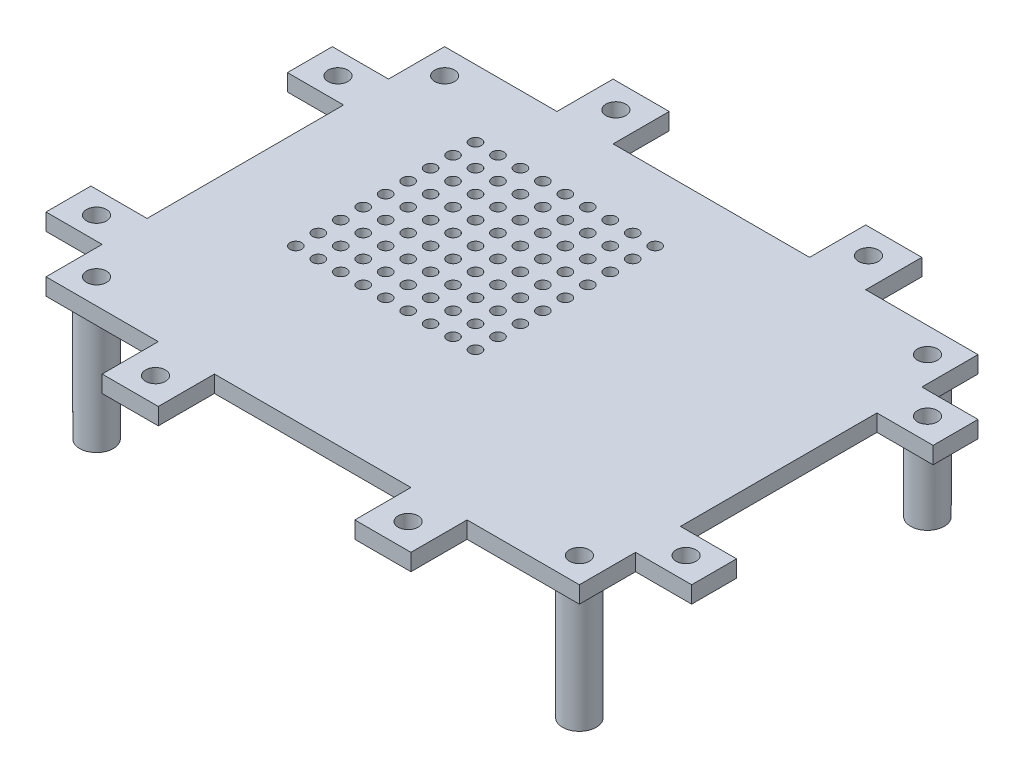
from build123d import *

# Parameters (mm, degrees)
BOSS_EXTRUDE1_DEPTH  = 3
SKETCH2_R            = 3
BOSS_EXTRUDE2_DEPTH  = 22
SKETCH3_R            = 1.775
CUT_EXTRUDE1_DEPTH   = 81.307853189
SKETCH4_R            = 1.05
CUT_EXTRUDE2_DEPTH   = 81.307853189
LPATTERN1_COUNT      = 9
LPATTERN1_PITCH      = 4
LPATTERN1_COUNT_DIR2 = 9
LPATTERN1_PITCH_DIR2 = 4
SKETCH5_R            = 1.775
CUT_EXTRUDE3_DEPTH   = 81.307853189
SKETCH6_R            = 1.775
CUT_EXTRUDE4_DEPTH   = 81.307853189


with BuildPart() as part:
    # Sketch1 → Boss-Extrude1 (new body)
    with BuildSketch(Plane(origin=(0, 0, 0), x_dir=(1, 0, 0), z_dir=(0, 1, 0))):
        Polygon((-50.932204957, 25.952341431), (-50.932204957, 35.952341431), (-30.932204957, 35.952341431), (-30.932204957, 45.952341431), (-20.932204957, 45.952341431), (-20.932204957, 35.952341431), (14.067795043, 35.952341431), (14.067795043, 45.952341431), (24.067795043, 45.952341431), (24.067795043, 35.952341431), (44.067795043, 35.952341431), (44.067795043, 25.952341431), (54.067795043, 25.952341431), (54.067795043, 17.952341431), (44.067795043, 17.952341431), (44.067795043, -17.047658569), (54.067795043, -17.047658569), (54.067795043, -25.047658569), (44.067795043, -25.047658569), (44.067795043, -35.047658569), (24.067795043, -35.047658569), (24.067795043, -45.047658569), (14.067795043, -45.047658569), (14.067795043, -35.047658569), (-20.932204957, -35.047658569), (-20.932204957, -45.047658569), (-30.932204957, -45.047658569), (-30.932204957, -35.047658569), (-50.932204957, -35.047658569), (-50.932204957, -25.047658569), (-60.932204957, -25.047658569), (-60.932204957, -17.047658569), (-50.932204957, -17.047658569), (-50.932204957, 17.952341431), (-60.932204957, 17.952341431), (-60.932204957, 25.952341431), align=None)
    extrude(amount=BOSS_EXTRUDE1_DEPTH)

    # Sketch2 → Boss-Extrude2 (add)
    with BuildSketch(Plane.XZ):
        with Locations(Location((-46.432204957, 30.547658569, 0), (0, 0, 90))):
            Circle(SKETCH2_R)
        with Locations(Location((-46.432204957, -31.452341431, 0), (0, 0, 90))):
            Circle(SKETCH2_R)
        with Locations(Location((39.567795043, -31.452341431, 0), (0, 0, 90))):
            Circle(SKETCH2_R)
        with Locations(Location((39.567795043, 30.547658569, 0), (0, 0, 90))):
            Circle(SKETCH2_R)
    extrude(amount=BOSS_EXTRUDE2_DEPTH)

    # Sketch3 → Cut-Extrude1 (cut, through all)
    with BuildSketch(Plane.XZ.offset(22)):
        with Locations(Location((-46.432204957, 30.547658569, 0), (0, 0, 270))):
            Circle(SKETCH3_R)
        with Locations(Location((-46.432204957, -31.452341431, 0), (0, 0, 270))):
            Circle(SKETCH3_R)
        with Locations(Location((39.567795043, -31.452341431, 0), (0, 0, 270))):
            Circle(SKETCH3_R)
        with Locations(Location((39.567795043, 30.547658569, 0), (0, 0, 270))):
            Circle(SKETCH3_R)
    extrude(amount=-CUT_EXTRUDE1_DEPTH, mode=Mode.SUBTRACT)

    # Sketch4 → Cut-Extrude2 (cut, through all)
    with BuildSketch(Plane(origin=(0, 3, 0), x_dir=(1, 0, 0), z_dir=(0, 1, 0))):
        with Locations(Location((-33.432204957, 23.952341431, 0), (0, 0, 270))):
            Circle(SKETCH4_R)
    cut_extrude2 = extrude(amount=-CUT_EXTRUDE2_DEPTH, mode=Mode.SUBTRACT)

    # LPattern1: Cut-Extrude2 9 × 9
    with Locations(*[(i * LPATTERN1_PITCH, 0, j * LPATTERN1_PITCH_DIR2) for i in range(LPATTERN1_COUNT) for j in range(LPATTERN1_COUNT_DIR2) if (i, j) != (0, 0)]):
        add(cut_extrude2, mode=Mode.SUBTRACT)

    # Sketch5 → Cut-Extrude3 (cut, through all)
    with BuildSketch(Plane(origin=(0, 3, 0), x_dir=(1, 0, 0), z_dir=(0, 1, 0))):
        with Locations(Location((-55.932204957, -21.047658569, 0), (0, 0, 270))):
            Circle(SKETCH5_R)
        with Locations(Location((-55.932204957, 21.952341431, 0), (0, 0, 270))):
            Circle(SKETCH5_R)
        with Locations(Location((49.067795043, 21.952341431, 0), (0, 0, 270))):
            Circle(SKETCH5_R)
        with Locations(Location((49.067795043, -21.047658569, 0), (0, 0, 270))):
            Circle(SKETCH5_R)
    extrude(amount=-CUT_EXTRUDE3_DEPTH, mode=Mode.SUBTRACT)

    # Sketch6 → Cut-Extrude4 (cut, through all)
    with BuildSketch(Plane(origin=(0, 3, 0), x_dir=(1, 0, 0), z_dir=(0, 1, 0))):
        with Locations(Location((-25.932204957, 41.452341431, 0), (0, 0, 270))):
            Circle(SKETCH6_R)
        with Locations(Location((19.067795043, 41.452341431, 0), (0, 0, 270))):
            Circle(SKETCH6_R)
        with Locations(Location((-25.932204957, -40.547658569, 0), (0, 0, 270))):
            Circle(SKETCH6_R)
        with Locations(Location((19.067795043, -40.547658569, 0), (0, 0, 270))):
            Circle(SKETCH6_R)
    extrude(amount=-CUT_EXTRUDE4_DEPTH, mode=Mode.SUBTRACT)


solid = part.part
